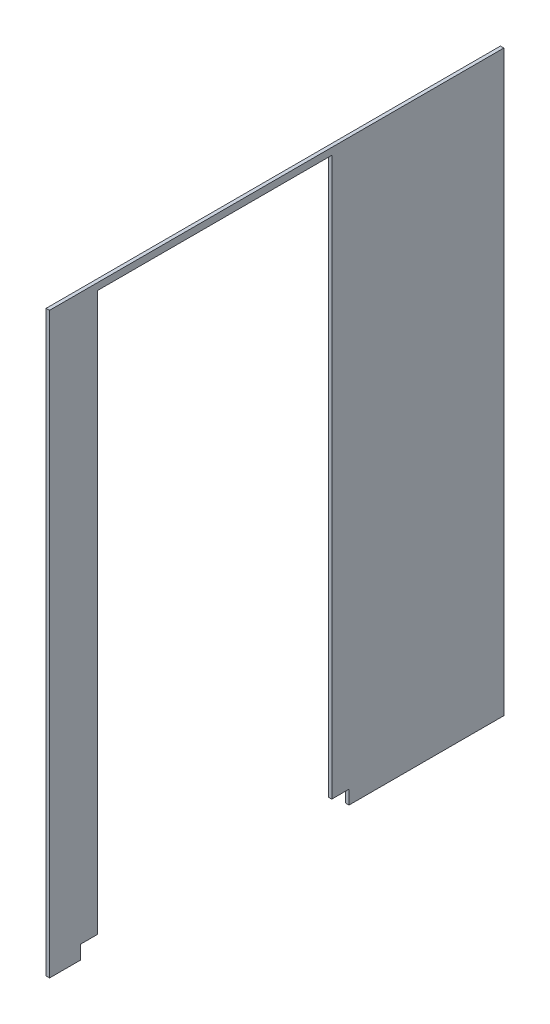
from build123d import *

# Parameters (mm, degrees)
BOSS_EXTRUDE1_DEPTH = 12.7


with BuildPart() as part:
    # Sketch1 → Boss-Extrude1 (new body)
    with BuildSketch(Plane(origin=(0, 0, 0), x_dir=(0, 0, -1), z_dir=(1, 0, 0))):
        Polygon((0, 0), (114.3, 0), (114.3, 50.8), (177.8, 50.8), (177.8, 2108.2), (1041.4, 2108.2), (1041.4, 50.8), (1104.9, 50.8), (1104.9, 0), (1676.4, 0), (1676.4, 2133.6), (0, 2133.6), align=None)
    extrude(amount=BOSS_EXTRUDE1_DEPTH)


solid = part.part
